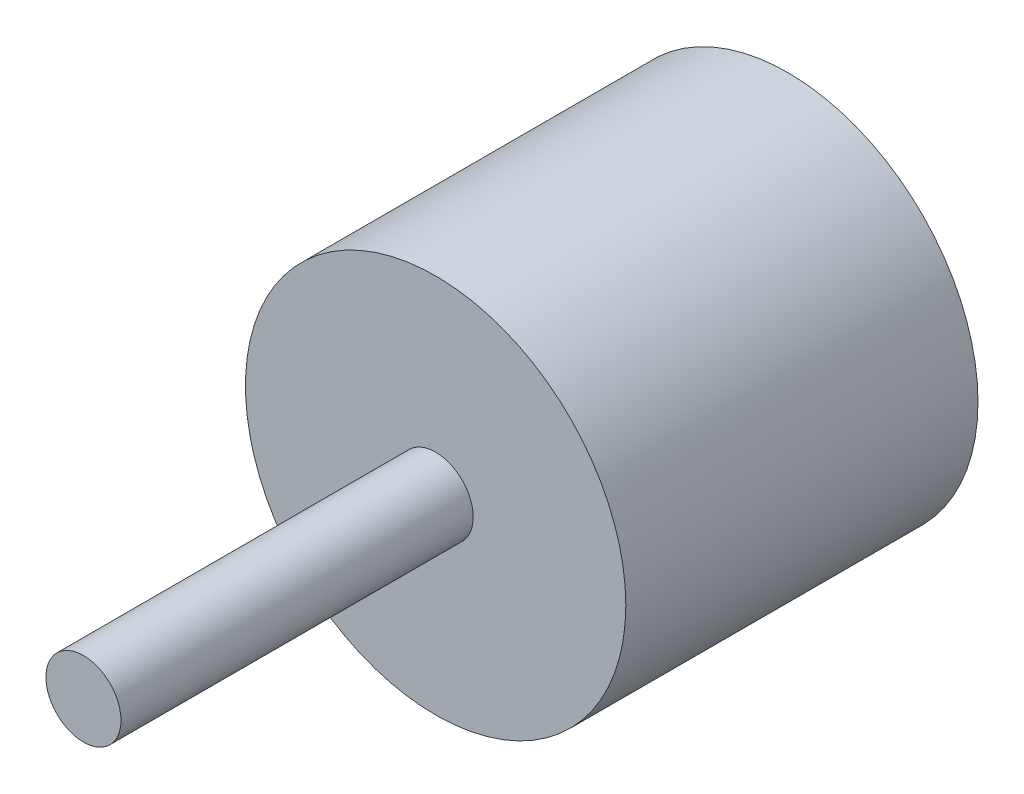
from build123d import *

# Parameters (mm, degrees)
SKETCH1_R           = 26.998187242
BOSS_EXTRUDE1_DEPTH = 50
SKETCH2_R           = 5.329038479
BOSS_EXTRUDE2_DEPTH = 50


with BuildPart() as part:
    # Sketch1 → Boss-Extrude1 (new body)
    with BuildSketch(Plane.XY):
        Circle(SKETCH1_R)
    extrude(amount=BOSS_EXTRUDE1_DEPTH)

    # Sketch2 → Boss-Extrude2 (add)
    with BuildSketch(Plane.XY.offset(50)):
        Circle(SKETCH2_R)
    extrude(amount=BOSS_EXTRUDE2_DEPTH)


solid = part.part
